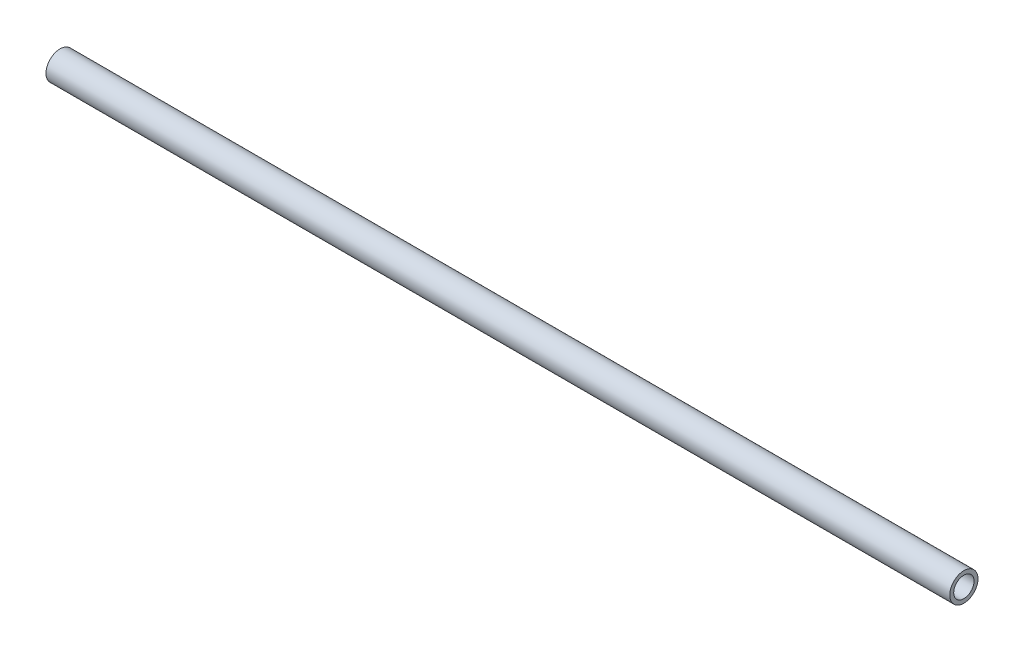
from build123d import *

# Parameters (mm, degrees)
SKETCH4_R           = 3.175
SKETCH4_R_2         = 2.286
BOSS_EXTRUDE1_DEPTH = 101.6


with BuildPart() as part:
    # Sketch4 → Boss-Extrude1 (new, symmetric)
    with BuildSketch(Plane(origin=(0, 0, 0), x_dir=(0, 0, -1), z_dir=(1, 0, 0))):
        Circle(SKETCH4_R)
        Circle(SKETCH4_R_2, mode=Mode.SUBTRACT)
    extrude(amount=BOSS_EXTRUDE1_DEPTH, both=True)


solid = part.part
